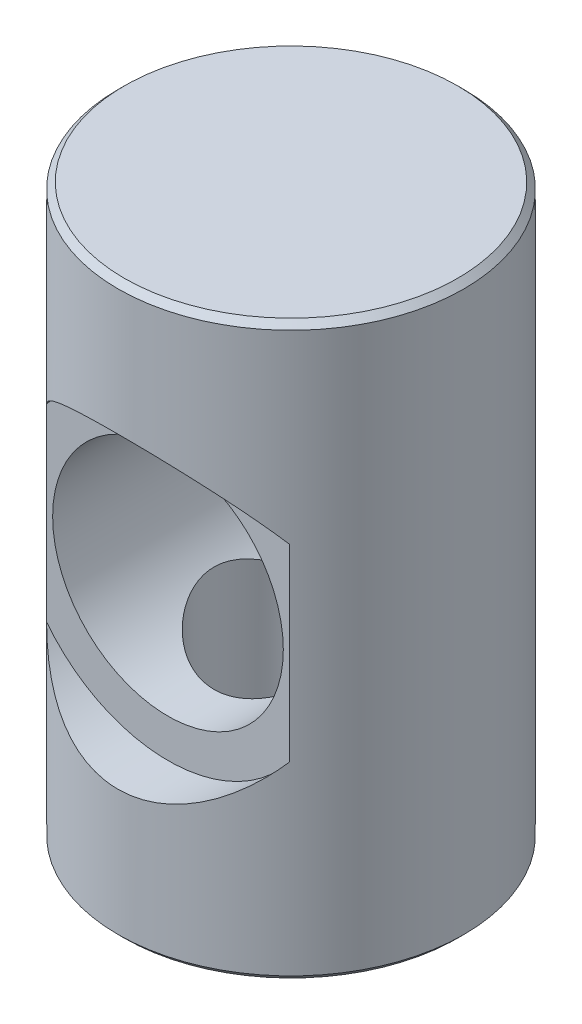
from build123d import *

# Parameters (mm, degrees)
SKETCH1_R               = 7.1374
BOSS_EXTRUDE1_DEPTH     = 23.5966
CHAMFER1_SIZE           = 0.254
CHAMFER2_SIZE           = 0.254
SKETCH2_R               = 4.7625
CUT_EXTRUDE1_DEPTH      = 7.1755
SKETCH3_R               = 6.35
CUT_EXTRUDE2_DEPTH      = 28.513757958
CUT_EXTRUDE3_REACH      = 27.665
CUT_EXTRUDE3_END_RADIUS = 4.7625
SKETCH4_R               = 3.175


with BuildPart() as part:
    # Sketch1 → Boss-Extrude1 (new body)
    with BuildSketch(Plane(origin=(0, 0, 0), x_dir=(1, 0, 0), z_dir=(0, 1, 0))):
        with Locations(Location((0, 0, 0), (0, 0, 90))):
            Circle(SKETCH1_R)
    extrude(amount=BOSS_EXTRUDE1_DEPTH)

    # Chamfer1
    chamfer1_edges = [part.edges().sort_by_distance(p)[0] for p in [
        (0, 0, 7.1374),
    ]]
    chamfer(chamfer1_edges, length=CHAMFER1_SIZE)

    # Chamfer2
    chamfer2_edges = [part.edges().sort_by_distance(p)[0] for p in [
        (0, 23.5966, 7.1374),
    ]]
    chamfer(chamfer2_edges, length=CHAMFER2_SIZE)

    # Sketch2 → Cut-Extrude1 (cut, symmetric)
    with BuildSketch(Plane.XY):
        with Locations(Location((0, 11.7983, 0), (0, 0, 89.999999998))):
            Circle(SKETCH2_R)
    extrude(amount=CUT_EXTRUDE1_DEPTH, both=True, mode=Mode.SUBTRACT)

    # Sketch3 → Cut-Extrude2 (cut, through all)
    with BuildSketch(Plane.XY.offset(5.08)):
        with Locations((0, 11.7983)):
            Circle(SKETCH3_R)
    cut_extrude2 = extrude(amount=CUT_EXTRUDE2_DEPTH, mode=Mode.SUBTRACT)

    # Mirror1: Cut-Extrude2 across plane
    add(cut_extrude2.mirror(Plane.XY), mode=Mode.SUBTRACT)

    # Cut-Extrude3: up to this cylinder (the profile starts outside it)
    cut_extrude3_end = Plane(origin=(0, 11.7983, 0), z_dir=(0, 0, 1)) * Cylinder(CUT_EXTRUDE3_END_RADIUS, 65.855, mode=Mode.PRIVATE)
    # Sketch4 → Cut-Extrude3 (cut, up to the surface)
    with BuildSketch(Plane.XZ, mode=Mode.PRIVATE) as cut_extrude3_sk1:
        with Locations(Location((0, 0, 0), (0, 0, 270))):
            Circle(SKETCH4_R)
    cut_extrude3_tool1 = extrude(cut_extrude3_sk1.sketch, amount=-CUT_EXTRUDE3_REACH, mode=Mode.PRIVATE) - cut_extrude3_end
    add(cut_extrude3_tool1.solids().sort_by_distance((0, 0, 0))[0], mode=Mode.SUBTRACT)


solid = part.part
